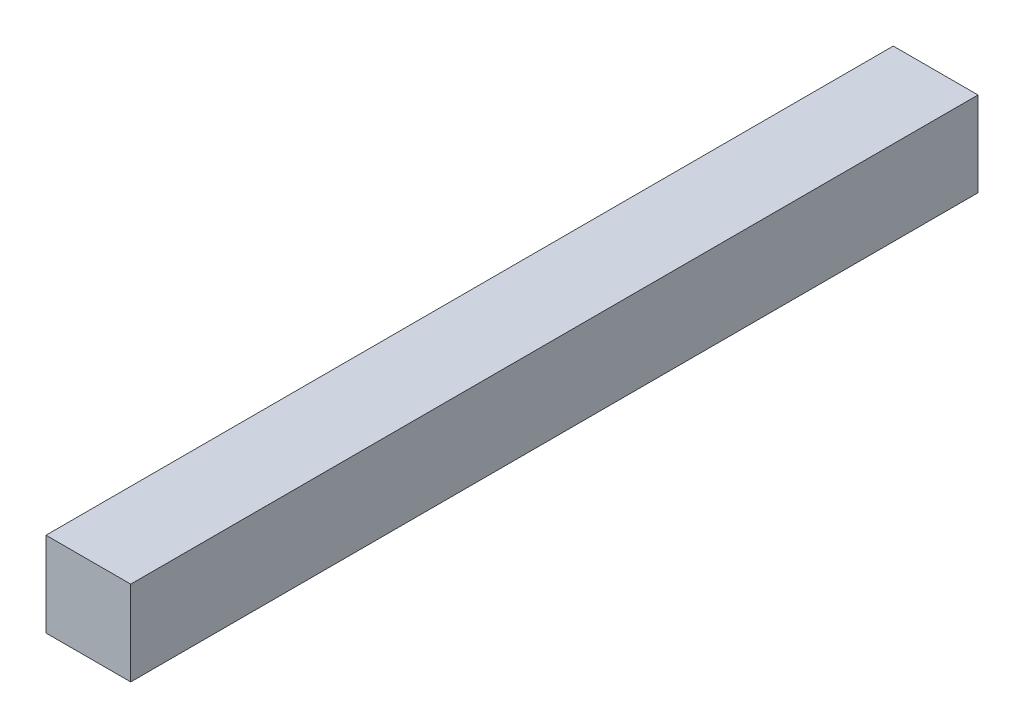
from build123d import *

# Parameters (mm, degrees)
SKETCH1_W           = 10
SKETCH1_H           = 10
BOSS_EXTRUDE1_DEPTH = 100


with BuildPart() as part:
    # Sketch1 → Boss-Extrude1 (new body)
    with BuildSketch(Plane.XY):
        with Locations((-1.658876957, 7.346667692)):
            Rectangle(SKETCH1_W, SKETCH1_H)
    extrude(amount=BOSS_EXTRUDE1_DEPTH)


solid = part.part
